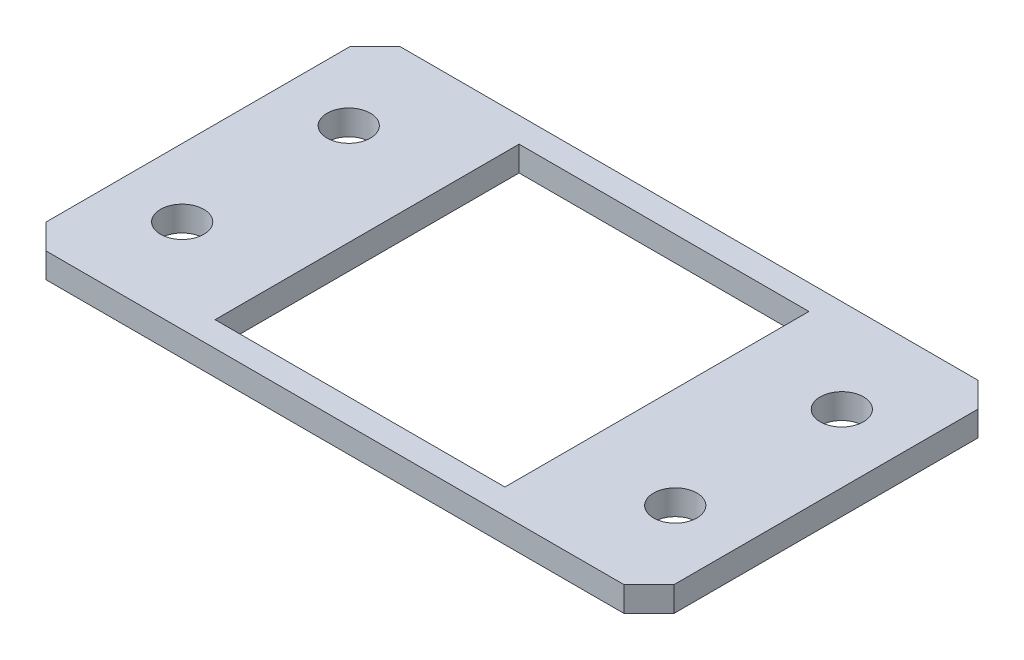
from build123d import *

# Parameters (mm, degrees)
SKETCH1_R           = 2.6
SKETCH1_W           = 34.8
SKETCH1_H           = 36.503761473
BOSS_EXTRUDE1_DEPTH = 3
CHAMFER1_SIZE       = 3


with BuildPart() as part:
    # Sketch1 → Boss-Extrude1 (new body)
    with BuildSketch(Plane(origin=(0, 0, 0), x_dir=(1, 0, 0), z_dir=(0, 1, 0))):
        Polygon((-36.075215726, -21.465620287), (-18.775215726, -21.465620287), (22.024784274, -21.465620287), (39.324784274, -21.465620287), (39.324784274, 21.038141186), (22.024784274, 21.038141186), (-18.775215726, 21.038141186), (-36.075215726, 21.038141186), align=None)
        with Locations((-27.925215726, -10.265620287)):
            Circle(SKETCH1_R, mode=Mode.SUBTRACT)
        with Locations((31.174784274, -10.161858814)):
            Circle(SKETCH1_R, mode=Mode.SUBTRACT)
        with Locations((-27.925215726, 9.734379713)):
            Circle(SKETCH1_R, mode=Mode.SUBTRACT)
        with Locations((1.624784274, -0.21373955)):
            Rectangle(SKETCH1_W, SKETCH1_H, mode=Mode.SUBTRACT)
        with Locations((31.174784274, 9.838141186)):
            Circle(SKETCH1_R, mode=Mode.SUBTRACT)
    extrude(amount=BOSS_EXTRUDE1_DEPTH)

    # Chamfer1
    chamfer1_edges = [part.edges().sort_by_distance(p)[0] for p in [
        (39.324784274, 1.5, -21.038141186),
        (39.324784274, 1.5, 21.465620287),
        (-36.075215726, 1.5, -21.038141186),
        (-36.075215726, 1.5, 21.465620287),
    ]]
    chamfer(chamfer1_edges, length=CHAMFER1_SIZE)


solid = part.part
